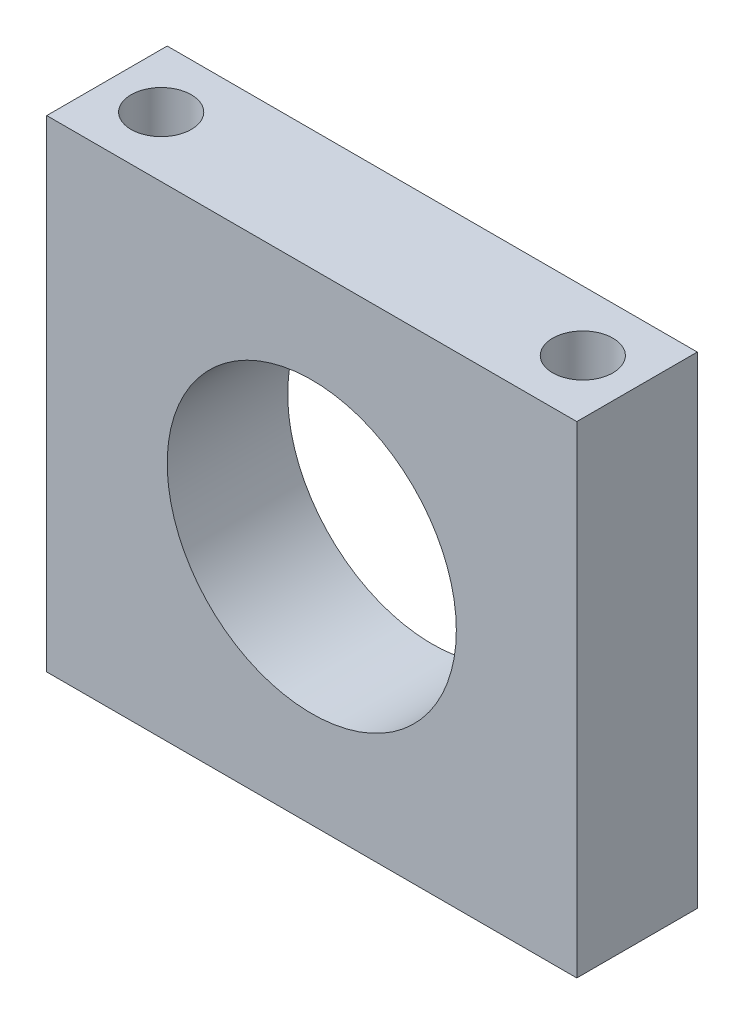
from build123d import *

# Parameters (mm, degrees)
BOSS_EXTRUDE1_DEPTH = 5
SKETCH11_R          = 1.25
CUT_EXTRUDE1_DEPTH  = 31.149626863


with BuildPart() as part:
    # Sketch1 → Boss-Extrude1 (new body)
    with BuildSketch(Plane.XY):
        with BuildLine():
            Line((0, 20), (0, 10))
            Line((0, 10), (5, 10))
            ThreePointArc((5, 10), (11, 16), (17, 10))
            Line((17, 10), (22, 10))
            Line((22, 10), (22, 20))
            Line((22, 20), (0, 20))
        make_face()
        with BuildLine():
            Line((0, 10), (0, 0))
            Line((0, 0), (22, 0))
            Line((22, 0), (22, 10))
            Line((22, 10), (17, 10))
            ThreePointArc((17, 10), (11, 4), (5, 10))
            Line((5, 10), (0, 10))
        make_face()
    extrude(amount=BOSS_EXTRUDE1_DEPTH)

    # Sketch11 → Cut-Extrude1 (cut, through all)
    with BuildSketch(Plane(origin=(0, 20, 0), x_dir=(1, 0, 0), z_dir=(0, 1, 0))):
        with Locations(Location((2.25, -2.5, 0), (0, 0, 270))):
            Circle(SKETCH11_R)
        with Locations(Location((19.75, -2.5, 0), (0, 0, 90))):
            Circle(SKETCH11_R)
    extrude(amount=-CUT_EXTRUDE1_DEPTH, mode=Mode.SUBTRACT)


solid = part.part
